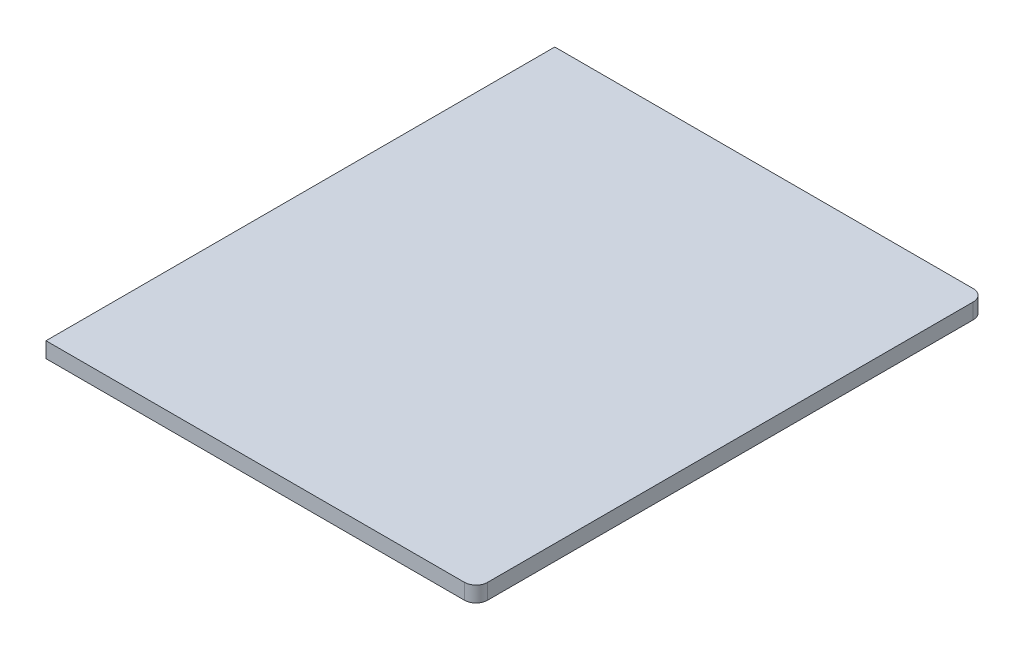
from build123d import *

# Parameters (mm, degrees)
BOSS_EXTRUDE1_DEPTH = 3.9
SKETCH1_6_R         = 2.1
CUT_EXTRUDE1_DEPTH  = 1.6


with BuildPart() as part:
    # Sketch1 → Boss-Extrude1 (new body)
    with BuildSketch(Plane(origin=(0, 0, 0), x_dir=(1, 0, 0), z_dir=(0, 1, 0))):
        with BuildLine():
            Line((-110, 63.829794385), (-110, -63.829794385))
            Line((-110, -63.829794385), (-5.000000025, -63.829794385))
            ThreePointArc((-5.000000025, -63.829794385), (-2.949390344, -62.98040406), (-2.1, -60.929794385))
            Line((-2.1, -60.929794385), (-2.1, 60.929794385))
            ThreePointArc((-2.1, 60.929794385), (-2.949390325, 62.980404041), (-4.999999974, 63.829794385))
            Line((-4.999999974, 63.829794385), (-110, 63.829794385))
        make_face()
    extrude(amount=BOSS_EXTRUDE1_DEPTH)

    # Sketch1<6> → Cut-Extrude1 (cut)
    with BuildSketch(Plane(origin=(0, 0, 0), x_dir=(1, 0, 0), z_dir=(0, 1, 0))):
        with Locations((-107, 60.929794385)):
            Circle(SKETCH1_6_R)
        with Locations((-5, 60.929794385)):
            Circle(SKETCH1_6_R)
        with Locations((-5, -60.929794385)):
            Circle(SKETCH1_6_R)
        with Locations((-107, -60.929794385)):
            Circle(SKETCH1_6_R)
    extrude(amount=CUT_EXTRUDE1_DEPTH, mode=Mode.SUBTRACT)


solid = part.part
